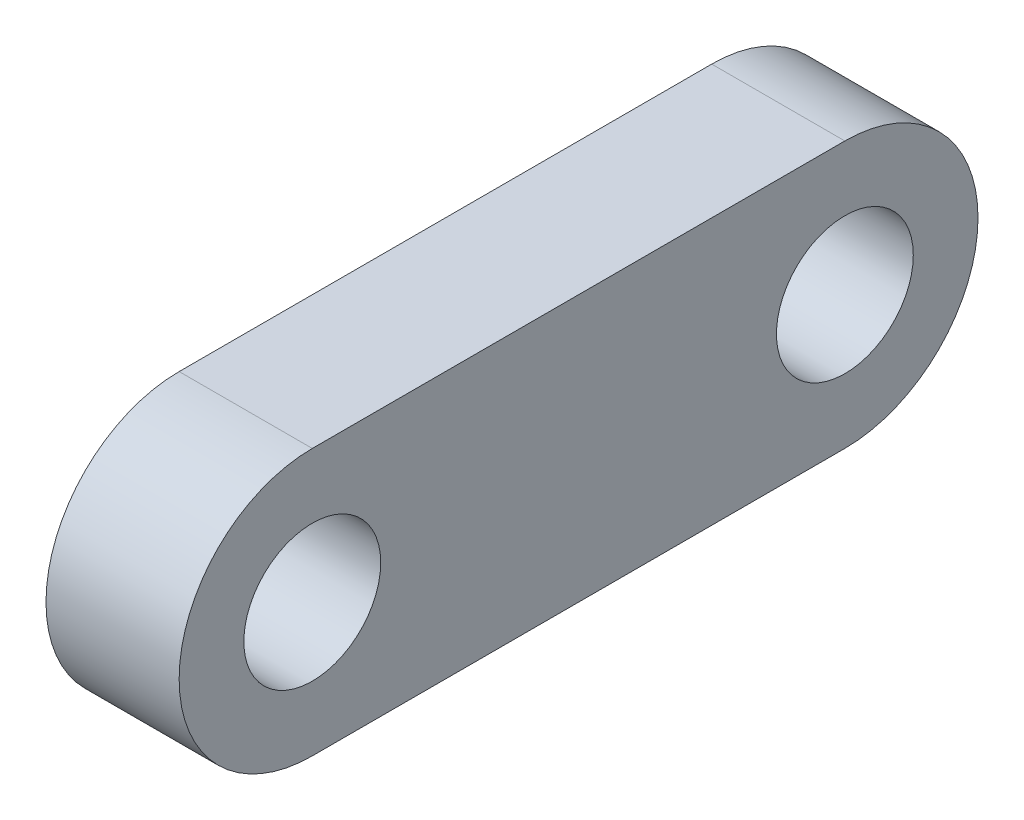
from build123d import *

# Parameters (mm, degrees)
BOSS_EXTRUDE1_DEPTH      = 6.35
F_5_16_18_TAPPED_HOLE1_D = 6.5278


with BuildPart() as part:
    # Sketch1 → Boss-Extrude1 (new body)
    with BuildSketch(Plane(origin=(0, 0, 0), x_dir=(0, 0, -1), z_dir=(1, 0, 0))):
        with BuildLine():
            Line((-12.7, 6.35), (12.7, 6.35))
            ThreePointArc((12.7, 6.35), (19.05, 0), (12.7, -6.35))
            Line((12.7, -6.35), (-12.7, -6.35))
            ThreePointArc((-12.7, -6.35), (-19.05, 0), (-12.7, 6.35))
        make_face()
    extrude(amount=BOSS_EXTRUDE1_DEPTH)

    # 5/16-18 Tapped Hole1 (through all)
    with Locations(Plane(origin=(6.35, 0, 0), x_dir=(0, 0, -1), z_dir=(1, 0, 0))):
        with Locations((-12.7, 0), (12.7, 0)):
            Hole(F_5_16_18_TAPPED_HOLE1_D / 2)


solid = part.part
